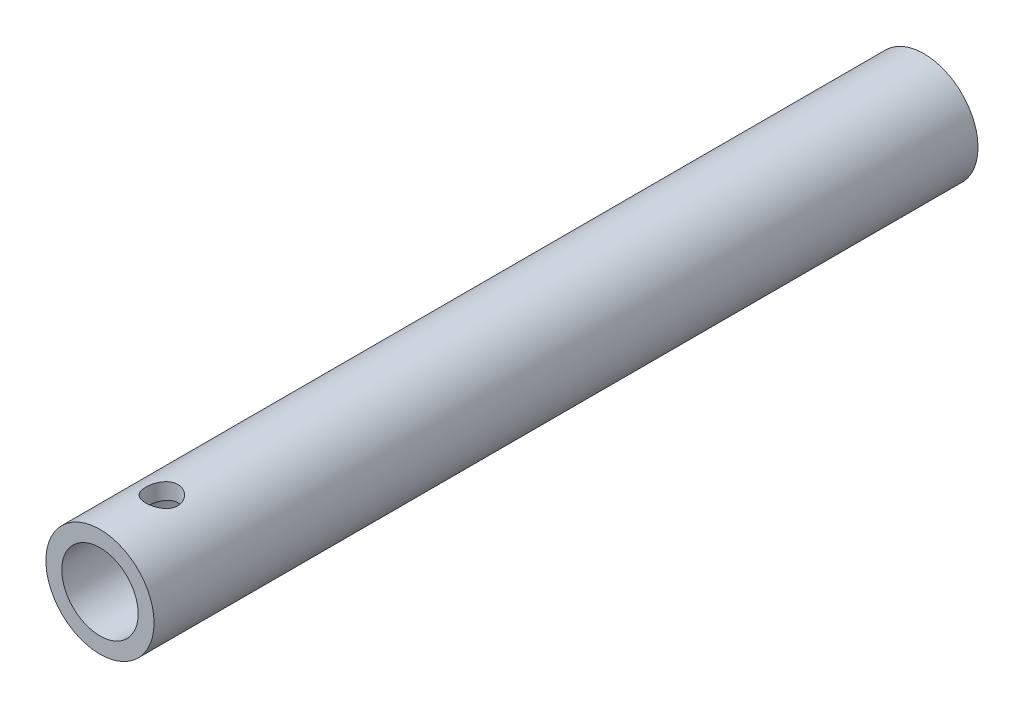
from build123d import *

# Parameters (mm, degrees)
SKETCH1_R               = 13.335
SKETCH1_R_2             = 9.4234
EXTRUDE_THIN1_DEPTH     = 101.6
CUT_EXTRUDE1_DEPTH      = 104.335397856
CUT_EXTRUDE1_DEPTH_BACK = 104.335397856
SKETCH2_R               = 3.96875


with BuildPart() as part:
    # Sketch1 → Extrude-Thin1 (new, symmetric)
    with BuildSketch(Plane.XY):
        Circle(SKETCH1_R)
        Circle(SKETCH1_R_2, mode=Mode.SUBTRACT)
    extrude(amount=EXTRUDE_THIN1_DEPTH, both=True)

    # Sketch2 → Cut-Extrude1 (cut, two sides: drawn at the far end of the back side and taken through both)
    with BuildSketch(Plane(origin=(0, 0, 0), x_dir=(1, 0, 0), z_dir=(0, 1, 0)).offset(-CUT_EXTRUDE1_DEPTH_BACK)):
        with Locations(Location((0, -86.36, 0), (0, 0, 270))):
            Circle(SKETCH2_R)
    extrude(amount=CUT_EXTRUDE1_DEPTH + CUT_EXTRUDE1_DEPTH_BACK, mode=Mode.SUBTRACT)


solid = part.part
